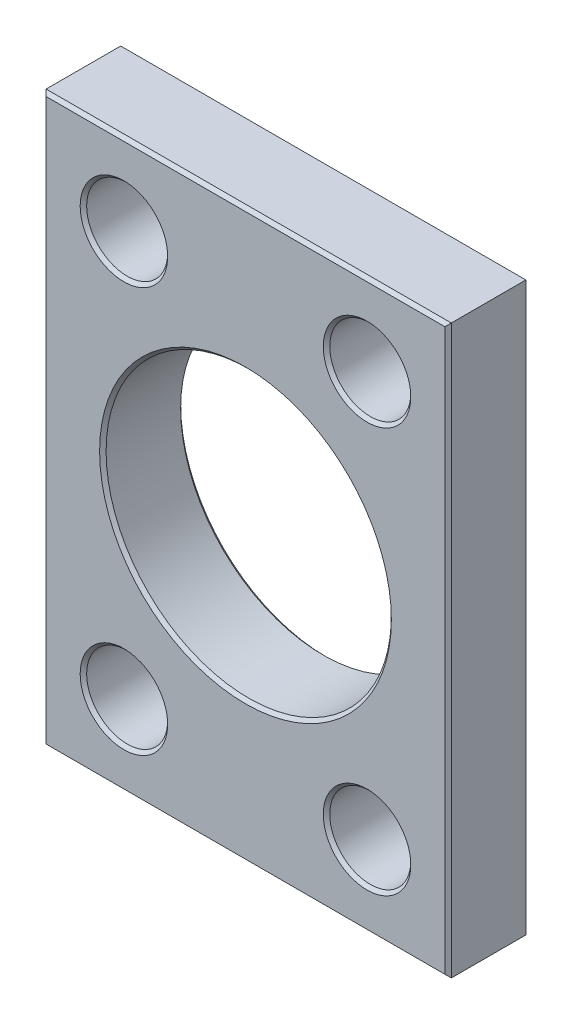
from build123d import *

# Parameters (mm, degrees)
SKETCH1_W           = 31.75
SKETCH1_H           = 44.45
SKETCH1_R           = 3.175
SKETCH1_R_2         = 11.176
BOSS_EXTRUDE1_DEPTH = 6.35
CHAMFER1_SIZE       = 0.254


with BuildPart() as part:
    # Sketch1 → Boss-Extrude1 (new body)
    with BuildSketch(Plane.XY):
        Rectangle(SKETCH1_W, SKETCH1_H)
        with Locations((-9.525, 15.875)):
            Circle(SKETCH1_R, mode=Mode.SUBTRACT)
        with Locations((9.525, 15.875)):
            Circle(SKETCH1_R, mode=Mode.SUBTRACT)
        with Locations((-9.525, -15.875)):
            Circle(SKETCH1_R, mode=Mode.SUBTRACT)
        with Locations((9.525, -15.875)):
            Circle(SKETCH1_R, mode=Mode.SUBTRACT)
        Circle(SKETCH1_R_2, mode=Mode.SUBTRACT)
    extrude(amount=BOSS_EXTRUDE1_DEPTH)

    # Chamfer1
    chamfer1_edges = [part.edges().sort_by_distance(p)[0] for p in [
        (-15.875, 0, 6.35),
        (-12.7, 15.875, 0),
        (-12.7, 15.875, 6.35),
        (0, -22.225, 6.35),
        (6.35, 15.875, 0),
        (6.35, 15.875, 6.35),
        (-12.7, -15.875, 0),
        (-12.7, -15.875, 6.35),
        (6.35, -15.875, 0),
        (6.35, -15.875, 6.35),
        (-11.176, 0, 0),
        (-11.176, 0, 6.35),
        (15.875, 0, 6.35),
        (0, -22.225, 0),
        (-15.875, 0, 0),
        (0, 22.225, 0),
        (15.875, 0, 0),
        (0, 22.225, 6.35),
    ]]
    chamfer(chamfer1_edges, length=CHAMFER1_SIZE)


solid = part.part
